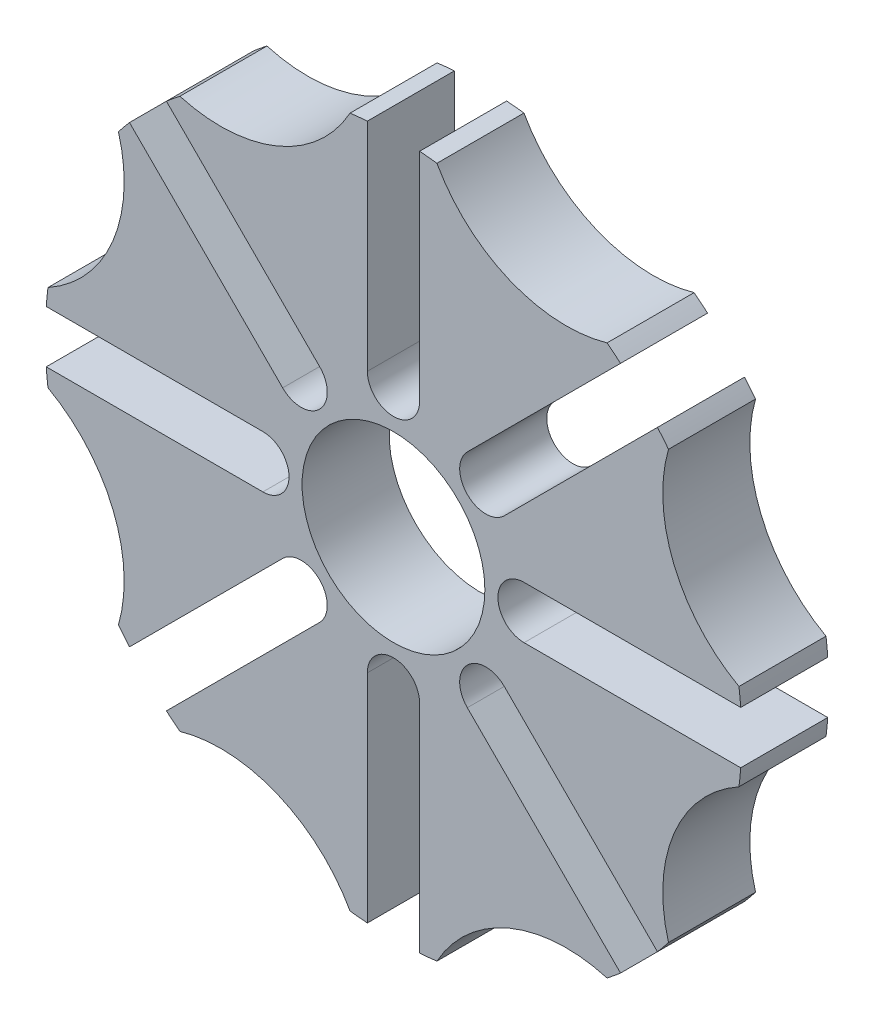
from build123d import *

# Parameters (mm, degrees)
SKETCH1_R           = 10.5
BOSS_EXTRUDE1_DEPTH = 5


with BuildPart() as part:
    # Sketch1 → Boss-Extrude1 (new, symmetric)
    with BuildSketch(Plane.XY):
        with BuildLine():
            Line((-3, 15), (-3, 39.88734135))
            ThreePointArc((-3, 39.88734135), (-3.996245887, 39.799874608), (-4.98999373, 39.687529056))
            ThreePointArc((-4.98999373, 39.687529056), (-13.349724383, 32.229085659), (-24.534862519, 31.591779329))
            ThreePointArc((-24.534862519, 31.591779329), (-25.31698866, 30.968533792), (-26.083289209, 30.325929896))
            Line((-26.083289209, 30.325929896), (-8.485281374, 12.727922061))
            ThreePointArc((-8.485281374, 12.727922061), (-8.485281374, 8.485281374), (-12.727922061, 8.485281374))
            Line((-12.727922061, 8.485281374), (-30.325929896, 26.083289209))
            ThreePointArc((-30.325929896, 26.083289209), (-30.968533792, 25.31698866), (-31.591779329, 24.534862519))
            ThreePointArc((-31.591779329, 24.534862519), (-32.229085659, 13.349724383), (-39.687529056, 4.98999373))
            ThreePointArc((-39.687529056, 4.98999373), (-39.799874608, 3.996245887), (-39.88734135, 3))
            Line((-39.88734135, 3), (-15, 3))
            ThreePointArc((-15, 3), (-12, 0), (-15, -3))
            Line((-15, -3), (-39.88734135, -3))
            ThreePointArc((-39.88734135, -3), (-39.799874608, -3.996245887), (-39.687529056, -4.98999373))
            ThreePointArc((-39.687529056, -4.98999373), (-32.229085659, -13.349724383), (-31.591779329, -24.534862519))
            ThreePointArc((-31.591779329, -24.534862519), (-30.968533792, -25.31698866), (-30.325929896, -26.083289209))
            Line((-30.325929896, -26.083289209), (-12.727922061, -8.485281374))
            ThreePointArc((-12.727922061, -8.485281374), (-8.485281374, -8.485281374), (-8.485281374, -12.727922061))
            Line((-8.485281374, -12.727922061), (-26.083289209, -30.325929896))
            ThreePointArc((-26.083289209, -30.325929896), (-25.31698866, -30.968533792), (-24.534862519, -31.591779329))
            ThreePointArc((-24.534862519, -31.591779329), (-13.349724383, -32.229085659), (-4.98999373, -39.687529056))
            ThreePointArc((-4.98999373, -39.687529056), (-3.996245887, -39.799874608), (-3, -39.88734135))
            Line((-3, -39.88734135), (-3, -15))
            ThreePointArc((-3, -15), (0, -12), (3, -15))
            Line((3, -15), (3, -39.88734135))
            ThreePointArc((3, -39.88734135), (3.996245887, -39.799874608), (4.98999373, -39.687529056))
            ThreePointArc((4.98999373, -39.687529056), (13.349724383, -32.229085659), (24.534862519, -31.591779329))
            ThreePointArc((24.534862519, -31.591779329), (25.31698866, -30.968533792), (26.083289209, -30.325929896))
            Line((26.083289209, -30.325929896), (8.485281374, -12.727922061))
            ThreePointArc((8.485281374, -12.727922061), (8.485281374, -8.485281374), (12.727922061, -8.485281374))
            Line((12.727922061, -8.485281374), (30.325929896, -26.083289209))
            ThreePointArc((30.325929896, -26.083289209), (30.968533792, -25.31698866), (31.591779329, -24.534862519))
            ThreePointArc((31.591779329, -24.534862519), (32.229085659, -13.349724383), (39.687529056, -4.98999373))
            ThreePointArc((39.687529056, -4.98999373), (39.799874608, -3.996245887), (39.88734135, -3))
            Line((39.88734135, -3), (15, -3))
            ThreePointArc((15, -3), (12, 0), (15, 3))
            Line((15, 3), (39.88734135, 3))
            ThreePointArc((39.88734135, 3), (39.799874608, 3.996245887), (39.687529056, 4.98999373))
            ThreePointArc((39.687529056, 4.98999373), (32.229085659, 13.349724383), (31.591779329, 24.534862519))
            ThreePointArc((31.591779329, 24.534862519), (30.968533792, 25.31698866), (30.325929896, 26.083289209))
            Line((30.325929896, 26.083289209), (12.727922061, 8.485281374))
            ThreePointArc((12.727922061, 8.485281374), (8.485281374, 8.485281374), (8.485281374, 12.727922061))
            Line((8.485281374, 12.727922061), (26.083289209, 30.325929896))
            ThreePointArc((26.083289209, 30.325929896), (25.31698866, 30.968533792), (24.534862519, 31.591779329))
            ThreePointArc((24.534862519, 31.591779329), (13.349724383, 32.229085659), (4.98999373, 39.687529056))
            ThreePointArc((4.98999373, 39.687529056), (3.996245887, 39.799874608), (3, 39.88734135))
            Line((3, 39.88734135), (3, 15))
            ThreePointArc((3, 15), (0, 12), (-3, 15))
        make_face()
        Circle(SKETCH1_R, mode=Mode.SUBTRACT)
    extrude(amount=BOSS_EXTRUDE1_DEPTH, both=True)


solid = part.part
